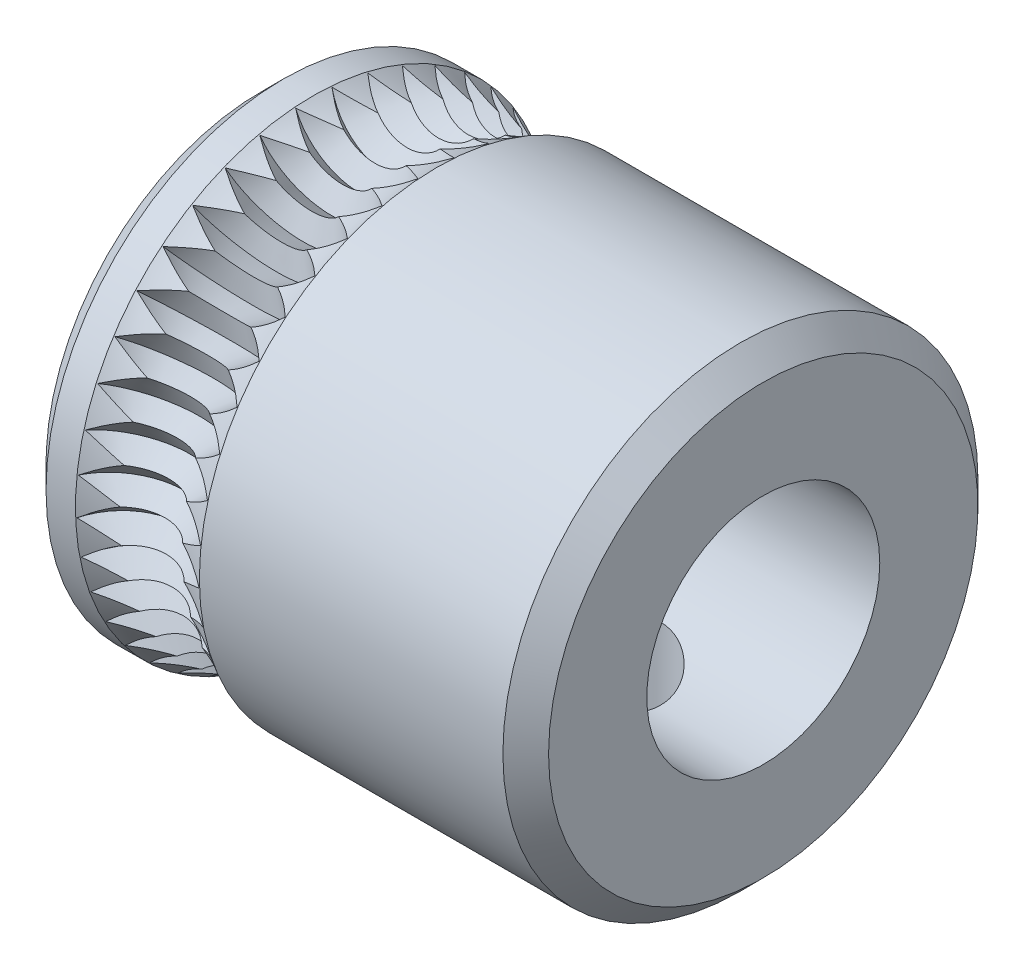
from build123d import *

# Parameters (mm, degrees)
SKETCH1_W          = 11
SKETCH1_H          = 5.2
SKETCH3_R          = 2.55
CUT_EXTRUDE2_DEPTH = 14.231779926
SKETCH6_R          = 2.5
SKETCH7_R          = 1.25
CUT_EXTRUDE3_DEPTH = 12.239661917
CIRPATTERN1_COUNT  = 41
CHAMFER1_SIZE      = 0.5


with BuildPart() as part:
    # Sketch1 → Revolve1 (revolve)
    with BuildSketch(Plane(origin=(0, 0, 0), x_dir=(1, 0, 0), z_dir=(0, 1, 0)), mode=Mode.PRIVATE) as revolve1_sk:
        with Locations((3, 2.6)):
            Rectangle(SKETCH1_W, SKETCH1_H)
    revolve(revolve1_sk.sketch.rotate(Axis((0, 0, 0), (1, 0, 0)), 180), axis=Axis((0, 0, 0), (1, 0, 0)))

    # Sketch3 → Cut-Extrude2 (cut, through all)
    with BuildSketch(Plane(origin=(8.5, 0, 0), x_dir=(0, 0, -1), z_dir=(1, 0, 0))):
        Circle(SKETCH3_R)
    extrude(amount=-CUT_EXTRUDE2_DEPTH, mode=Mode.SUBTRACT)

    # Sketch6 → Cut-Revolve1 (revolve, cut)
    with BuildSketch(Plane.XY, mode=Mode.PRIVATE) as cut_revolve1_sk:
        with Locations((0, 7.3)):
            Circle(SKETCH6_R)
    revolve(cut_revolve1_sk.sketch.rotate(Axis((0, 0, 0), (1, 0, 0)), 90), axis=Axis((0, 0, 0), (1, 0, 0)), mode=Mode.SUBTRACT)

    # Sketch7 → Cut-Extrude3 (cut, through all)
    with BuildSketch(Plane(origin=(0, 0, 0), x_dir=(1, 0, 0), z_dir=(0, 1, 0))):
        with Locations(Location((5, 0, 0), (0, 0, 270))):
            Circle(SKETCH7_R)
    extrude(amount=-CUT_EXTRUDE3_DEPTH, mode=Mode.SUBTRACT)

    # Sketch8 → Cut-Revolve4 (revolve, cut)
    with BuildSketch(Plane(origin=(0, 0, 0), x_dir=(0, 0, -1), z_dir=(1, 0, 0))):
        Polygon((-0.523556195, -4.771361327), (0, -4.2), (0.523556195, -4.771361327), (0.523556195, -5.6), (-0.523556195, -5.6), align=None)
    cut_revolve4 = revolve(axis=Axis((0, -5.6, -0.523556195), (0, 0, -1)), mode=Mode.SUBTRACT)

    # CirPattern1: Cut-Revolve4 ×41 about axis
    cirpattern1_axis = Axis((-2.5, 0, 0), (1, 0, 0))
    for i in range(1, CIRPATTERN1_COUNT):
        add(cut_revolve4.rotate(cirpattern1_axis, i * 360 / CIRPATTERN1_COUNT), mode=Mode.SUBTRACT)

    # Chamfer1
    chamfer1_edges = [part.edges().sort_by_distance(p)[0] for p in [
        (-2.5, 0, -5.2),
        (8.5, 0, -5.2),
    ]]
    chamfer(chamfer1_edges, length=CHAMFER1_SIZE)


solid = part.part
